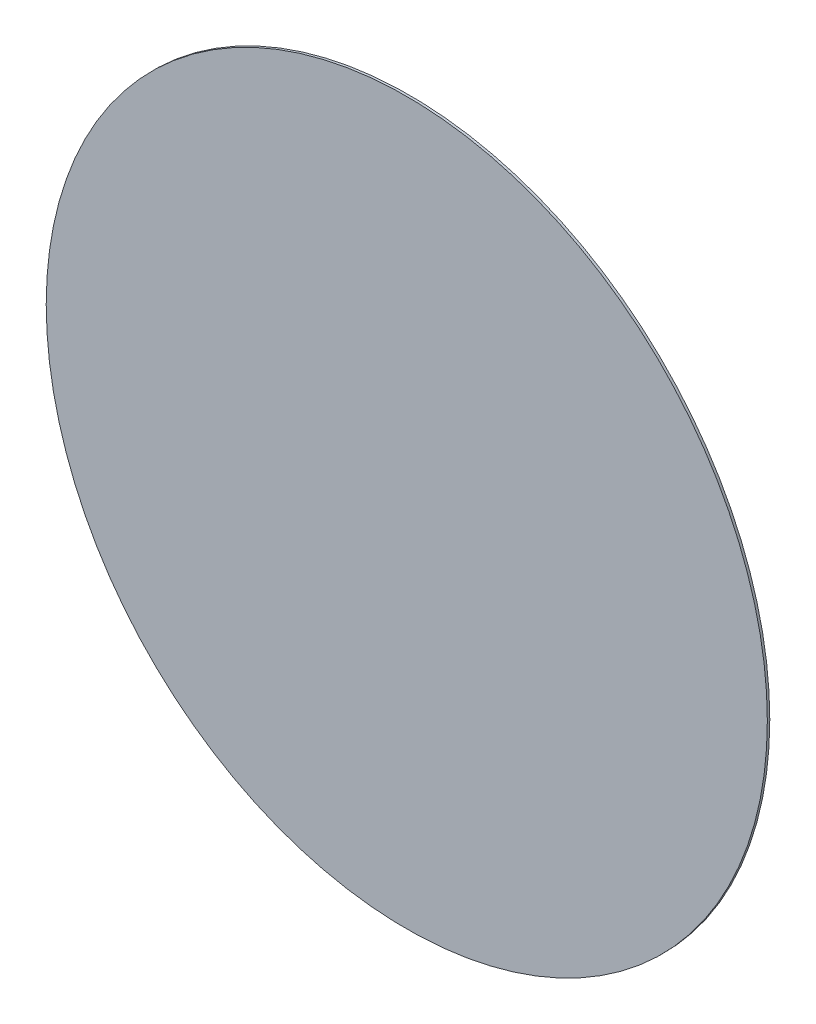
from build123d import *

# Parameters (mm, degrees)
CURVESKETCH_R   = 1731.719
CURVEBOSS_DEPTH = 11.731


with BuildPart() as part:
    # CurveSketch → CurveBoss (new body)
    with BuildSketch(Plane.XY):
        with Locations((-3.719, 5.173)):
            Circle(CURVESKETCH_R)
    extrude(amount=CURVEBOSS_DEPTH)


solid = part.part
